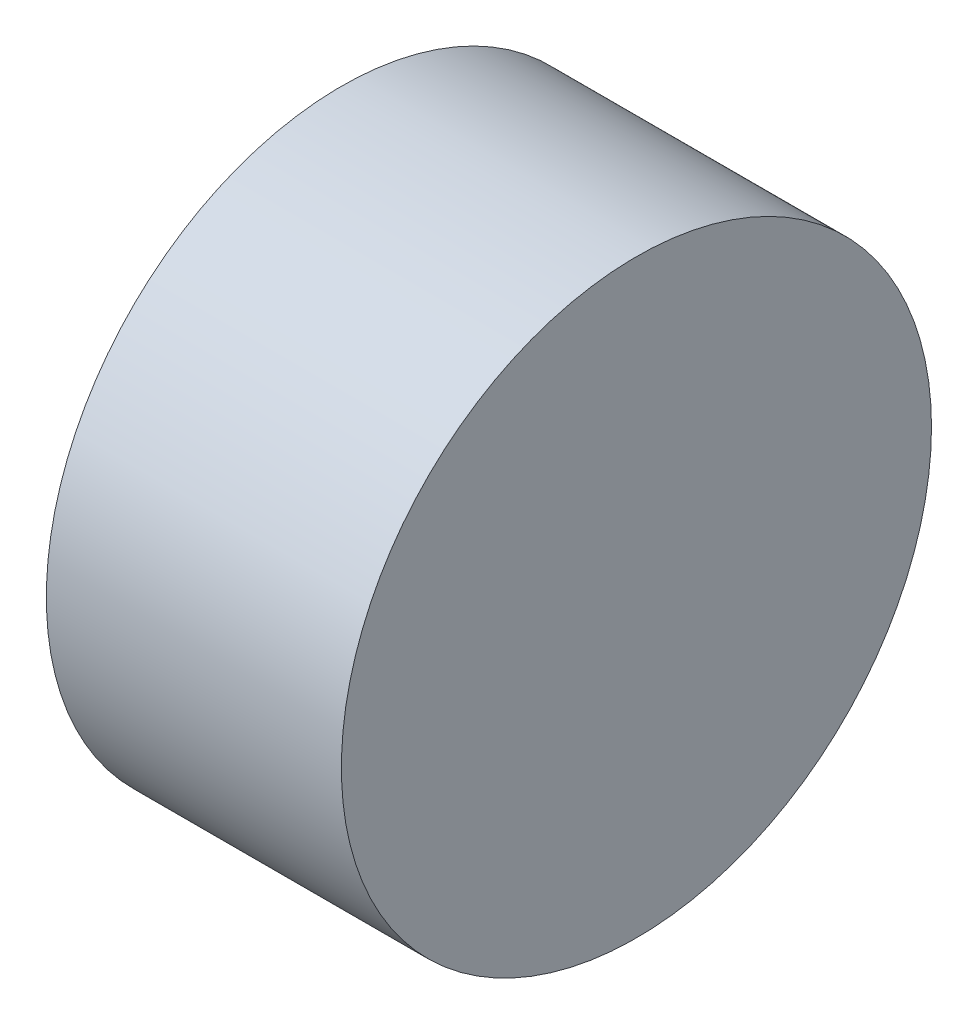
from build123d import *

# Parameters (mm, degrees)
SKETCH1_R           = 30
BOSS_EXTRUDE1_DEPTH = 30
CUT_EXTRUDE1_DEPTH  = 10


with BuildPart() as part:
    # Sketch1 → Boss-Extrude1 (new body)
    with BuildSketch(Plane(origin=(0, 0, 0), x_dir=(0, 0, -1), z_dir=(1, 0, 0))):
        Circle(SKETCH1_R)
    extrude(amount=BOSS_EXTRUDE1_DEPTH)

    # Sketch2 → Cut-Extrude1 (cut)
    with BuildSketch(Plane.ZY):
        Polygon((3.050745315, -2.135521721), (3.374788718, 1.574262083), (0.324043403, 3.709783804), (-3.050745315, 2.135521721), (-3.374788718, -1.574262083), (-0.324043403, -3.709783804), align=None)
    extrude(amount=-CUT_EXTRUDE1_DEPTH, mode=Mode.SUBTRACT)


solid = part.part
